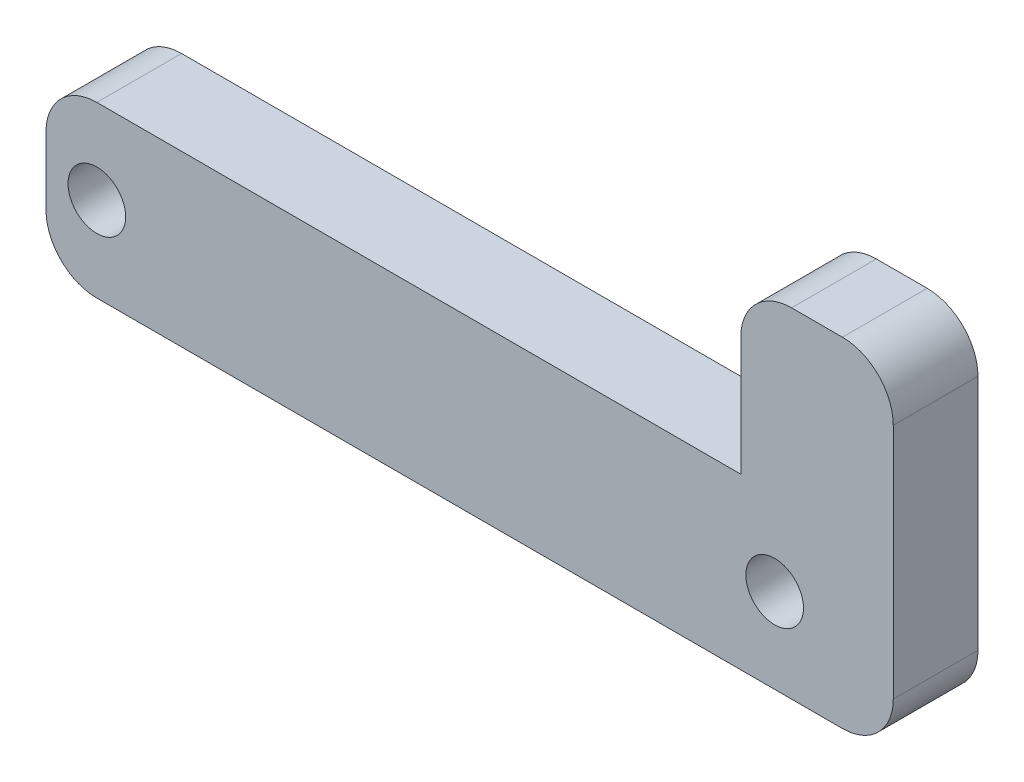
from build123d import *

# Parameters (mm, degrees)
SKETCH_1_W          = 46
SKETCH_1_H          = 20
SKETCH_1_R          = 1.7
EXTRUDE_1_DEPTH     = 5
SKETCH_3_W          = 41
SKETCH_3_H          = 10
CUT_EXTRUDE_1_DEPTH = 5
FILLET_1_R          = 3
SKETCH_4_W          = 4
SKETCH_4_H          = 20
EXTRUDE_2_DEPTH     = 5
FILLET_2_R          = 3
FILLET_3_R          = 3


with BuildPart() as part:
    # 草图1 → 凸台-拉伸1 (new body)
    with BuildSketch(Plane.XY):
        with Locations((23, 10)):
            Rectangle(SKETCH_1_W, SKETCH_1_H)
        with Locations((3, 5)):
            Circle(SKETCH_1_R, mode=Mode.SUBTRACT)
        with Locations((43, 5)):
            Circle(SKETCH_1_R, mode=Mode.SUBTRACT)
    extrude(amount=-EXTRUDE_1_DEPTH)

    # 草图3 → 切除-拉伸1 (cut)
    with BuildSketch(Plane.XY):
        with Locations((20.5, 15)):
            Rectangle(SKETCH_3_W, SKETCH_3_H)
    extrude(amount=-CUT_EXTRUDE_1_DEPTH, mode=Mode.SUBTRACT)

    # 圆角1
    fillet_1_edges = [part.edges().sort_by_distance(p)[0] for p in [
        (0, 10, -2.5),
        (41, 20, -2.5),
    ]]
    fillet(fillet_1_edges, radius=FILLET_1_R)

    # 草图4 → 凸台-拉伸2 (add)
    with BuildSketch(Plane.XY):
        with Locations((48, 10)):
            Rectangle(SKETCH_4_W, SKETCH_4_H)
    extrude(amount=-EXTRUDE_2_DEPTH)

    # 圆角2
    fillet_2_edges = [part.edges().sort_by_distance(p)[0] for p in [
        (50, 20, -2.5),
        (50, 0, -2.5),
    ]]
    fillet(fillet_2_edges, radius=FILLET_2_R)

    # 圆角3
    fillet_3_edges = [part.edges().sort_by_distance(p)[0] for p in [
        (0, 0, -2.5),
    ]]
    fillet(fillet_3_edges, radius=FILLET_3_R)


solid = part.part
